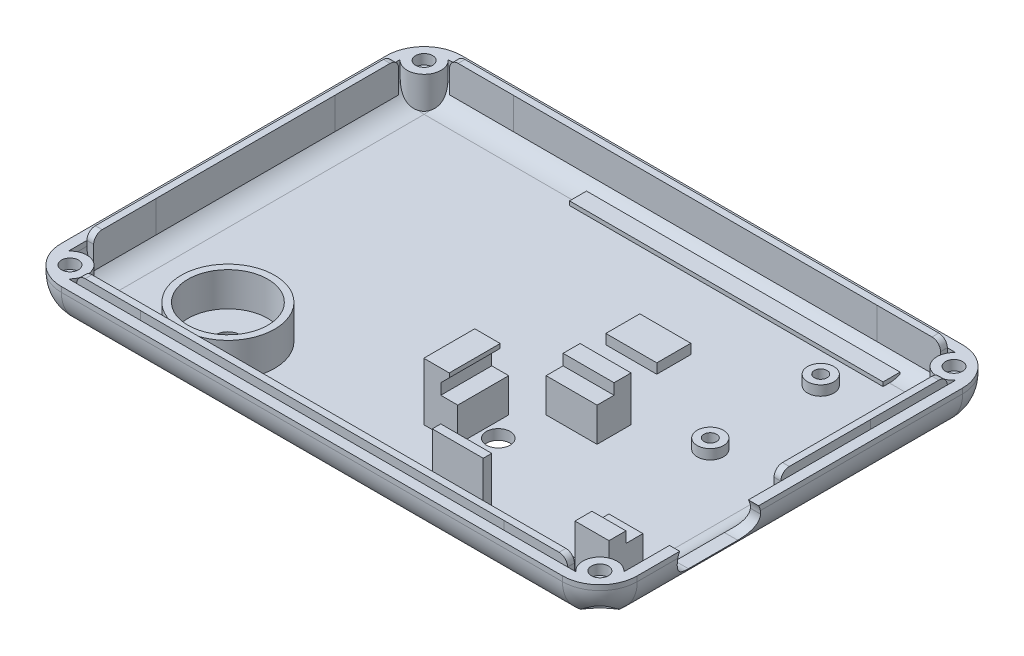
from build123d import *
from build123d.topology import SkipClean

# Parameters (mm, degrees)
SKETCH7_W                 = 86.089362547
SKETCH7_H                 = 59.817
EXTRUDE1_DEPTH            = 6.35
FILLET1_R                 = 5.588
FILLET2_R                 = 5.588
SHELL1_T                  = -1.524
EDGE_GUIDES_REACH         = 107.107
FILLET3_R                 = 1.27
SKETCH9_R                 = 1.778
TEENSY_RESET_HOLE_DEPTH   = 106.007680903
SKETCH10_W                = 5.08
SKETCH10_H                = 7.62
SKETCH10_H_2              = 5.08
SKETCH10_W_2              = 7.62
SKETCH10_H_3              = 1.27
TEENSY_PILONS_DEPTH       = 5.08
SKETCH11_W                = 5.08
SKETCH11_H                = 2.54
SKETCH11_W_2              = 2.54
SKETCH11_H_2              = 7.62
SKETCH11_W_3              = 7.62
SKETCH11_H_3              = 1.27
TEENSY_PILON_EDGES_DEPTH  = 1.6256
TEENSY_LOCK_DEPTH         = 7.62
USB_CUTOUT_DEPTH          = 11.43
SKETCH13_R                = 1.9685
SKETCH13_R_2              = 0.9525
SKETCH13_W                = 7.62
SKETCH13_H                = 5.08
SUPPLY_MOUNTS_DEPTH       = 3
SKETCH14_R                = 0.9525
SUPPLY_MOUNT_HOLES_DEPTH  = 1.524
CORNER_BOSSES_REACH       = 107.023
SKETCH15_R                = 2.54
SKETCH16_R                = 1.27
CORNER_SCREW_HOLES_DEPTH  = 106.022732545
CORNER_START              = -2
SKETCH17_R                = 2.032
CORNER_BACKCUTS_DEPTH     = 104.022732545
SKETCH18_R                = 1.9685
CORNER_BLANK_OUTS_DEPTH   = 0.508
BEEPER_HOLE_REACH         = 107.319
SKETCH20_R                = 1.778
SKETCH21_R                = 6.985
SKETCH21_R_2              = 5.969
BEEPER_RING_DEPTH         = 5.08
SKETCH28_R                = 5.969
BEEPER_BOTTOM_CLEAR_DEPTH = 1.778
SKETCH26_W                = 37.7571
SKETCH26_H                = 2.54
SKETCH26_W_2              = 46.8757
SCREEN_SHIMS_DEPTH        = 0.6096


with BuildPart() as part:
    # Sketch7 → Extrude1 (new body)
    with BuildSketch(Plane(origin=(0, 0, 0), x_dir=(1, 0, 0), z_dir=(0, 1, 0))):
        with Locations((43.044681274, 29.9085)):
            Rectangle(SKETCH7_W, SKETCH7_H)
    extrude(amount=EXTRUDE1_DEPTH)

    # Fillet1
    fillet1_edges = [part.edges().sort_by_distance(p)[0] for p in [
        (0, 3.175, -59.817),
        (86.089362547, 3.175, -59.817),
        (86.089362547, 3.175, 0),
        (0, 3.175, 0),
    ]]
    fillet(fillet1_edges, radius=FILLET1_R)

    # Fillet2
    fillet2_edges = [part.edges().sort_by_distance(p)[0] for p in [
        (0, 0, -29.9085),
        (43.044681273, 0, -59.817),
        (86.089362547, 0, -29.9085),
        (43.044681273, 0, 0),
        (1.636687307, 0, -1.636687307),
        (84.45267524, 0, -1.636687307),
        (84.45267524, 0, -58.180312693),
        (1.636687307, 0, -58.180312693),
    ]]
    fillet(fillet2_edges, radius=FILLET2_R)

    # Shell1
    shell1_openings = [part.faces().sort_by_distance(p)[0] for p in [
        (43.044681273, 6.35, -29.9085),
    ]]
    offset(amount=SHELL1_T, openings=shell1_openings, kind=Kind.INTERSECTION)

    # Sketch8 → Edge guides (add, up to next)
    with BuildSketch(Plane(origin=(0, 7.62, 0), x_dir=(-1, 0, 0), z_dir=(0, 1, 0)), mode=Mode.PRIVATE) as edge_guides_sk1:
        Polygon((-1.524, -53.467), (-2.54, -53.467), (-2.54, -43.942), (-2.54, -17.168350906), (-2.54, -7.875231611), (-1.524, -7.875231611), (-1.524, -17.168350906), (-1.524, -43.942), align=None)
    edge_guides_tool1 = extrude(edge_guides_sk1.sketch, amount=-EDGE_GUIDES_REACH, mode=Mode.PRIVATE) - part.part
    # Sketch8 → Edge guides (add, up to next)
    with BuildSketch(Plane(origin=(0, 7.62, 0), x_dir=(-1, 0, 0), z_dir=(0, 1, 0)), mode=Mode.PRIVATE) as edge_guides_sk2:
        Polygon((-70.214362547, -2.54), (-15.875, -2.54), (-6.35, -2.54), (-6.35, -1.524), (-15.875, -1.524), (-70.214362547, -1.524), (-79.739362547, -1.524), (-79.739362547, -2.54), align=None)
    edge_guides_tool2 = extrude(edge_guides_sk2.sketch, amount=-EDGE_GUIDES_REACH, mode=Mode.PRIVATE) - part.part
    # Sketch8 → Edge guides (add, up to next)
    with BuildSketch(Plane(origin=(0, 7.62, 0), x_dir=(-1, 0, 0), z_dir=(0, 1, 0)), mode=Mode.PRIVATE) as edge_guides_sk3:
        Polygon((-84.565362547, -28.575), (-83.549362547, -28.575), (-83.549362547, -43.942), (-83.549362547, -53.467), (-84.565362547, -53.467), (-84.565362547, -42.00628039), align=None)
    edge_guides_tool3 = extrude(edge_guides_sk3.sketch, amount=-EDGE_GUIDES_REACH, mode=Mode.PRIVATE) - part.part
    # Sketch8 → Edge guides (add, up to next)
    with BuildSketch(Plane(origin=(0, 7.62, 0), x_dir=(-1, 0, 0), z_dir=(0, 1, 0)), mode=Mode.PRIVATE) as edge_guides_sk4:
        Polygon((-79.739362547, -58.293), (-70.214362547, -58.293), (-15.875, -58.293), (-6.35, -58.293), (-6.35, -57.277), (-15.875, -57.277), (-70.214362547, -57.277), (-79.739362547, -57.277), align=None)
    edge_guides_tool4 = extrude(edge_guides_sk4.sketch, amount=-EDGE_GUIDES_REACH, mode=Mode.PRIVATE) - part.part
    add(edge_guides_tool1.solids().sort_by_distance((2.032, 7.62, -30.671116))[0])
    add(edge_guides_tool2.solids().sort_by_distance((43.044681, 7.62, -2.032))[0])
    add(edge_guides_tool3.solids().sort_by_distance((84.057363, 7.62, -41.021))[0])
    add(edge_guides_tool4.solids().sort_by_distance((43.044681, 7.62, -57.785))[0])

    # Fillet3
    fillet3_edges = [part.edges().sort_by_distance(p)[0] for p in [
        (84.057362547, 7.62, -53.467),
        (84.057362547, 7.62, -28.575),
        (6.35, 7.62, -2.032),
        (79.739362547, 7.62, -2.032),
        (79.739362547, 7.62, -57.785),
        (6.35, 7.62, -57.785),
        (2.032, 7.62, -7.875231611),
        (2.032, 7.62, -53.467),
    ]]
    fillet(fillet3_edges, radius=FILLET3_R)

    # Sketch9 → Teensy reset hole (cut, through all)
    with BuildSketch(Plane(origin=(0, 1.524, 0), x_dir=(-1, 0, 0), z_dir=(0, 1, 0))):
        with Locations(Location((-53.069362547, -17.8308, 0), (0, 0, 90))):
            Circle(SKETCH9_R)
    extrude(amount=-TEENSY_RESET_HOLE_DEPTH, mode=Mode.SUBTRACT)

    # Sketch10 → Teensy pilons (add)
    with BuildSketch(Plane(origin=(0, 1.524, 0), x_dir=(-1, 0, 0), z_dir=(0, 1, 0))):
        with Locations((-48.281462547, -17.8308)):
            Rectangle(SKETCH10_W, SKETCH10_H)
        with Locations((-78.761462547, -8.6868)):
            Rectangle(SKETCH10_W, SKETCH10_H_2)
        with Locations((-57.425462547, -26.9748)):
            Rectangle(SKETCH10_W_2, SKETCH10_H_2)
        with Locations((-57.425462547, -8.0518)):
            Rectangle(SKETCH10_W_2, SKETCH10_H_3)
    extrude(amount=TEENSY_PILONS_DEPTH)

    # Sketch11 → Teensy pilon edges (add)
    with BuildSketch(Plane(origin=(0, 6.604, 0), x_dir=(-1, 0, 0), z_dir=(0, 1, 0))):
        with Locations((-78.761462547, -7.4168)):
            Rectangle(SKETCH11_W, SKETCH11_H)
        with Locations((-47.011462547, -17.8308)):
            Rectangle(SKETCH11_W_2, SKETCH11_H_2)
        with Locations((-57.425462547, -8.0518)):
            Rectangle(SKETCH11_W_3, SKETCH11_H_3)
        with Locations((-57.425462547, -28.2448)):
            Rectangle(SKETCH11_W_3, SKETCH11_H)
    extrude(amount=TEENSY_PILON_EDGES_DEPTH)

    # Sketch25 → Teensy lock (add)
    with BuildSketch(Plane(origin=(0, 0, -21.6408), x_dir=(-1, 0, 0), z_dir=(0, 0, -1))):
        Polygon((-48.281462547, 8.2296), (-49.551462547, 9.4996), (-49.551462547, 10.1346), (-45.741462547, 10.1346), (-45.741462547, 8.2296), align=None)
    extrude(amount=-TEENSY_LOCK_DEPTH)

    # Sketch12 → USB cutout (cut)
    with BuildSketch(Plane(origin=(86.089362547, 0, 0), x_dir=(0, 0, -1), z_dir=(1, 0, 0))):
        with BuildLine():
            Line((21.5392, 7.62), (14.1224, 7.62))
            ThreePointArc((14.1224, 7.62), (12.344309288, 6.883490712), (11.6078, 5.1054))
            Line((11.6078, 5.1054), (11.6078, 5.08))
            ThreePointArc((11.6078, 5.08), (12.351748776, 3.283948776), (14.1478, 2.54))
            Line((14.1478, 2.54), (21.5138, 2.54))
            ThreePointArc((21.5138, 2.54), (23.309851224, 3.283948776), (24.0538, 5.08))
            Line((24.0538, 5.08), (24.0538, 5.1054))
            ThreePointArc((24.0538, 5.1054), (23.317290712, 6.883490712), (21.5392, 7.62))
        make_face()
    extrude(amount=-USB_CUTOUT_DEPTH, mode=Mode.SUBTRACT)

    # Sketch13 → Supply mounts (add)
    # profile 1 of 3: a face of its own
    with BuildSketch(Plane(origin=(0, 0, 0), x_dir=(-1, 0, 0), z_dir=(0, 1, 0))):
        with Locations(Location((-70.341362547, -48.768, 0), (0, 0, 90))):
            Circle(SKETCH13_R)
        with Locations(Location((-70.341362547, -48.768, 0), (0, 0, 90))):
            Circle(SKETCH13_R_2, mode=Mode.SUBTRACT)
    # profile 2 of 3: a face of its own
    with BuildSketch(Plane(origin=(0, 0, 0), x_dir=(-1, 0, 0), z_dir=(0, 1, 0))):
        with Locations(Location((-70.341362547, -32.258, 0), (0, 0, 90))):
            Circle(SKETCH13_R)
        with Locations(Location((-70.341362547, -32.258, 0), (0, 0, 90))):
            Circle(SKETCH13_R_2, mode=Mode.SUBTRACT)
    # profile 3 of 3: a face of its own
    with BuildSketch(Plane(origin=(0, 0, 0), x_dir=(-1, 0, 0), z_dir=(0, 1, 0))):
        with Locations((-52.815362547, -40.513)):
            Rectangle(SKETCH13_W, SKETCH13_H)
    extrude(amount=SUPPLY_MOUNTS_DEPTH)

    # Sketch14 → Supply mount holes (cut)
    with BuildSketch(Plane(origin=(0, 0, 0), x_dir=(1, 0, 0), z_dir=(0, 1, 0))):
        with Locations(Location((70.341362547, 32.258, 0), (0, 0, 270))):
            Circle(SKETCH14_R)
        with Locations(Location((70.341362547, 48.768, 0), (0, 0, 270))):
            Circle(SKETCH14_R)
    extrude(amount=SUPPLY_MOUNT_HOLES_DEPTH, mode=Mode.SUBTRACT)

    # Sketch15 → Corner bosses (add, up to next)
    with BuildSketch(Plane(origin=(0, 6.35, 0), x_dir=(-1, 0, 0), z_dir=(0, 1, 0)), mode=Mode.PRIVATE) as corner_bosses_sk1:
        with Locations((-3.432738531, -56.384261469)):
            Circle(SKETCH15_R)
    corner_bosses_tool1 = extrude(corner_bosses_sk1.sketch, amount=-CORNER_BOSSES_REACH, mode=Mode.PRIVATE) - part.part
    # Sketch15 → Corner bosses (add, up to next)
    with BuildSketch(Plane(origin=(0, 6.35, 0), x_dir=(-1, 0, 0), z_dir=(0, 1, 0)), mode=Mode.PRIVATE) as corner_bosses_sk2:
        with Locations((-3.432738531, -3.432738531)):
            Circle(SKETCH15_R)
    corner_bosses_tool2 = extrude(corner_bosses_sk2.sketch, amount=-CORNER_BOSSES_REACH, mode=Mode.PRIVATE) - part.part
    # Sketch15 → Corner bosses (add, up to next)
    with BuildSketch(Plane(origin=(0, 6.35, 0), x_dir=(-1, 0, 0), z_dir=(0, 1, 0)), mode=Mode.PRIVATE) as corner_bosses_sk3:
        with Locations((-82.656624016, -3.432738531)):
            Circle(SKETCH15_R)
    corner_bosses_tool3 = extrude(corner_bosses_sk3.sketch, amount=-CORNER_BOSSES_REACH, mode=Mode.PRIVATE) - part.part
    # Sketch15 → Corner bosses (add, up to next)
    with BuildSketch(Plane(origin=(0, 6.35, 0), x_dir=(-1, 0, 0), z_dir=(0, 1, 0)), mode=Mode.PRIVATE) as corner_bosses_sk4:
        with Locations((-82.656624016, -56.384261469)):
            Circle(SKETCH15_R)
    corner_bosses_tool4 = extrude(corner_bosses_sk4.sketch, amount=-CORNER_BOSSES_REACH, mode=Mode.PRIVATE) - part.part
    add(corner_bosses_tool1.solids().sort_by_distance((3.432739, 6.35, -56.384261))[0])
    add(corner_bosses_tool2.solids().sort_by_distance((3.432739, 6.35, -3.432739))[0])
    add(corner_bosses_tool3.solids().sort_by_distance((82.656624, 6.35, -3.432739))[0])
    add(corner_bosses_tool4.solids().sort_by_distance((82.656624, 6.35, -56.384261))[0])

    # Sketch16 → Corner screw holes (cut, through all)
    with BuildSketch(Plane(origin=(0, 6.35, 0), x_dir=(-1, 0, 0), z_dir=(0, 1, 0))):
        with Locations(Location((-82.656624016, -3.432738531, 0), (0, 0, 90))):
            Circle(SKETCH16_R)
        with Locations(Location((-3.432738531, -3.432738531, 0), (0, 0, 90))):
            Circle(SKETCH16_R)
        with Locations(Location((-82.656624016, -56.384261469, 0), (0, 0, 90))):
            Circle(SKETCH16_R)
        with Locations(Location((-3.432738531, -56.384261469, 0), (0, 0, 90))):
            Circle(SKETCH16_R)
    extrude(amount=-CORNER_SCREW_HOLES_DEPTH, mode=Mode.SUBTRACT)

    # Sketch17 → Corner backcuts (cut, through all)
    with BuildSketch(Plane(origin=(0, 6.35, 0), x_dir=(-1, 0, 0), z_dir=(0, 1, 0)).offset(CORNER_START)):
        with Locations(Location((-82.656624016, -3.432738531, 0), (0, 0, 90))):
            Circle(SKETCH17_R)
        with Locations(Location((-3.432738531, -3.432738531, 0), (0, 0, 90))):
            Circle(SKETCH17_R)
        with Locations(Location((-3.432738531, -56.384261469, 0), (0, 0, 90))):
            Circle(SKETCH17_R)
        with Locations(Location((-82.656624016, -56.384261469, 0), (0, 0, 90))):
            Circle(SKETCH17_R)
    extrude(amount=-CORNER_BACKCUTS_DEPTH, mode=Mode.SUBTRACT)

    # Sketch18 → Corner blank outs (add)
    with BuildSketch(Plane.XZ.offset(-4.35)):
        with Locations((3.432738531, -3.432738531)):
            Circle(SKETCH18_R)
        with Locations((82.656624016, -3.432738531)):
            Circle(SKETCH18_R)
        with Locations((82.656624016, -56.384261469)):
            Circle(SKETCH18_R)
        with Locations((3.432738531, -56.384261469)):
            Circle(SKETCH18_R)
    extrude(amount=-CORNER_BLANK_OUTS_DEPTH)

    # Sketch20 → beeper hole (cut, up to next)
    with BuildSketch(Plane(origin=(0, 0, 0), x_dir=(1, 0, 0), z_dir=(0, 1, 0)), mode=Mode.PRIVATE) as beeper_hole_sk1:
        with Locations(Location((20.32, 10.16, 0), (0, 0, 270))):
            Circle(SKETCH20_R)
    beeper_hole_tool1 = extrude(beeper_hole_sk1.sketch, amount=BEEPER_HOLE_REACH, mode=Mode.PRIVATE) & part.part
    add(beeper_hole_tool1.solids().sort_by_distance((20.32, 0, -10.16))[0], mode=Mode.SUBTRACT)

    # Sketch21 → beeper ring (add)
    with BuildSketch(Plane(origin=(0, 1.524, 0), x_dir=(-1, 0, 0), z_dir=(0, 1, 0))):
        with Locations(Location((-20.32, -10.16, 0), (0, 0, 139.114807107))):
            Circle(SKETCH21_R)
        with Locations(Location((-20.32, -10.16, 0), (0, 0, 130.007753913))):
            Circle(SKETCH21_R_2, mode=Mode.SUBTRACT)
    extrude(amount=BEEPER_RING_DEPTH)

    # Sketch28 → beeper bottom clear (cut)
    with SkipClean():  # the faces are left unmerged after this step: merging them gives an invalid solid
        with BuildSketch(Plane(origin=(0, 1.524, 0), x_dir=(-1, 0, 0), z_dir=(0, 1, 0))):
            with Locations(Location((-20.32, -10.16, 0), (0, 0, 90))):
                Circle(SKETCH28_R)
        extrude(amount=BEEPER_BOTTOM_CLEAR_DEPTH, mode=Mode.SUBTRACT)

    # Sketch26 → Screen shims (add)
    with SkipClean():  # the faces are left unmerged after this step: merging them gives an invalid solid
        with BuildSketch(Plane(origin=(0, 1.524, 0), x_dir=(-1, 0, 0), z_dir=(0, 1, 0))):
            with Locations((-56.365012547, -6.223)):
                Rectangle(SKETCH26_W, SKETCH26_H)
            with Locations((-51.704112547, -54.5592)):
                Rectangle(SKETCH26_W_2, SKETCH26_H)
        extrude(amount=SCREEN_SHIMS_DEPTH)


solid = part.part
